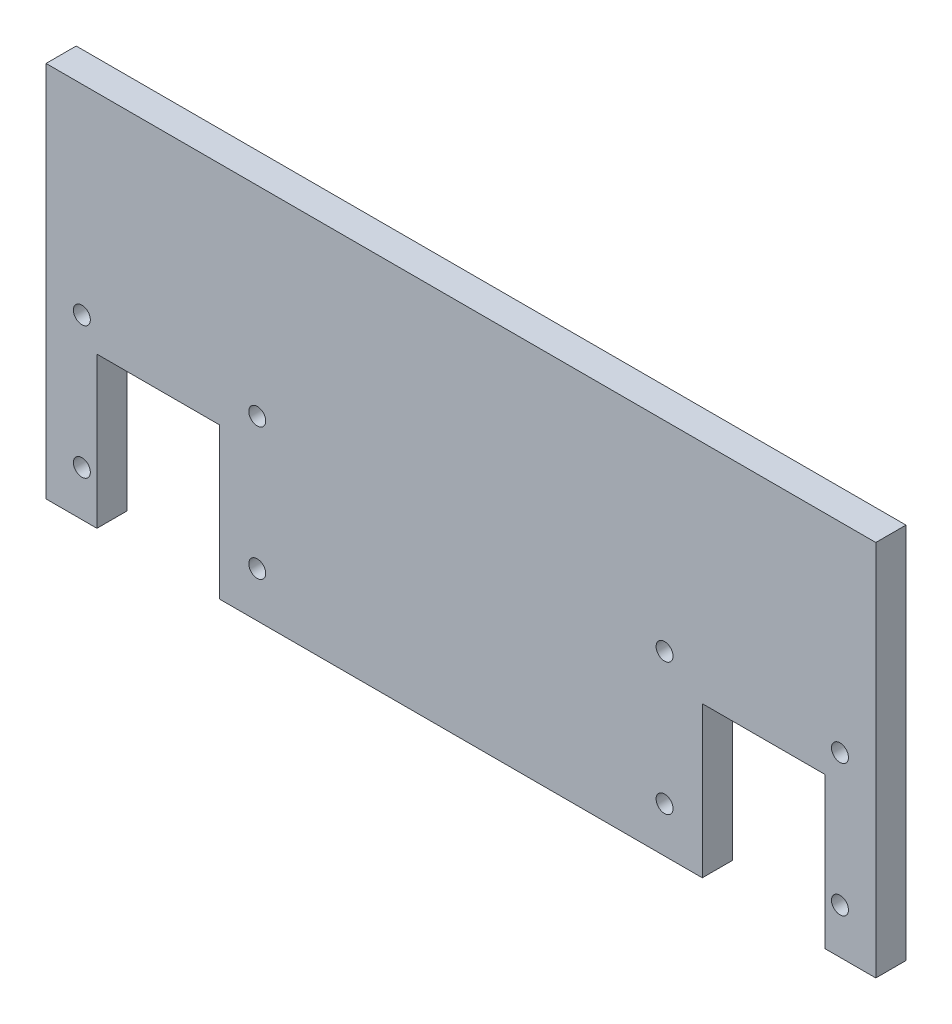
from build123d import *

# Parameters (mm, degrees)
ESQUISSE1_W                  = 220
ESQUISSE1_H                  = 100
BOSS_EXTRU_1_DEPTH           = 8
ESQUISSE2_R                  = 2
ENL_V_MAT_EXTRU_1_DEPTH      = 8
ENL_V_MAT_EXTRU_6_DEPTH      = 242.793300155
ENL_V_MAT_EXTRU_6_DEPTH_BACK = 242.793300155
ESQUISSE8_W                  = 32.5
ESQUISSE8_H                  = 40
ENL_V_MAT_EXTRU_8_DEPTH      = 242.793300155
ENL_V_MAT_EXTRU_8_DEPTH_BACK = 242.793300155
ESQUISSE10_R                 = 2.25


with BuildPart() as part:
    # Esquisse1 → Boss.-Extru.1 (new body)
    with BuildSketch(Plane.XY):
        with Locations((110, 50)):
            Rectangle(ESQUISSE1_W, ESQUISSE1_H)
    extrude(amount=BOSS_EXTRU_1_DEPTH)

    # Esquisse2 → Enlèv. mat.-Extru.1 (cut)
    with BuildSketch(Plane.XZ):
        with Locations(Location((110, 4, 0), (0, 0, 270))):
            Circle(ESQUISSE2_R)
        with Locations(Location((213, 4, 0), (0, 0, 270))):
            Circle(ESQUISSE2_R)
        with Locations(Location((7, 4, 0), (0, 0, 90))):
            Circle(ESQUISSE2_R)
    extrude(amount=-ENL_V_MAT_EXTRU_1_DEPTH, mode=Mode.SUBTRACT)

    # Esquisse8 → Enlèv. mat.-Extru.6 (cut, two sides: drawn at the far end of the back side and taken through both)
    with BuildSketch(Plane.XY.offset(8).offset(-ENL_V_MAT_EXTRU_6_DEPTH_BACK)):
        with Locations((190.25, 20)):
            Rectangle(ESQUISSE8_W, ESQUISSE8_H)
        with Locations((29.75, 20)):
            Rectangle(ESQUISSE8_W, ESQUISSE8_H)
    extrude(amount=ENL_V_MAT_EXTRU_6_DEPTH + ENL_V_MAT_EXTRU_6_DEPTH_BACK, mode=Mode.SUBTRACT)

    # Esquisse10 → Enlèv. mat.-Extru.8 (cut, two sides: drawn at the far end of the back side and taken through both)
    with BuildSketch(Plane.XY.offset(8).offset(-ENL_V_MAT_EXTRU_8_DEPTH_BACK)):
        with Locations((9.5, 12)):
            Circle(ESQUISSE10_R)
        with Locations((9.5, 47)):
            Circle(ESQUISSE10_R)
        with Locations(Location((210.5, 47, 0), (0, 0, 180))):
            Circle(ESQUISSE10_R)
        with Locations(Location((210.5, 12, 0), (0, 0, 180))):
            Circle(ESQUISSE10_R)
        with Locations(Location((56, 47, 0), (0, 0, 180))):
            Circle(ESQUISSE10_R)
        with Locations(Location((56, 12, 0), (0, 0, 180))):
            Circle(ESQUISSE10_R)
        with Locations((164, 12)):
            Circle(ESQUISSE10_R)
        with Locations((164, 47)):
            Circle(ESQUISSE10_R)
    extrude(amount=ENL_V_MAT_EXTRU_8_DEPTH + ENL_V_MAT_EXTRU_8_DEPTH_BACK, mode=Mode.SUBTRACT)


solid = part.part
